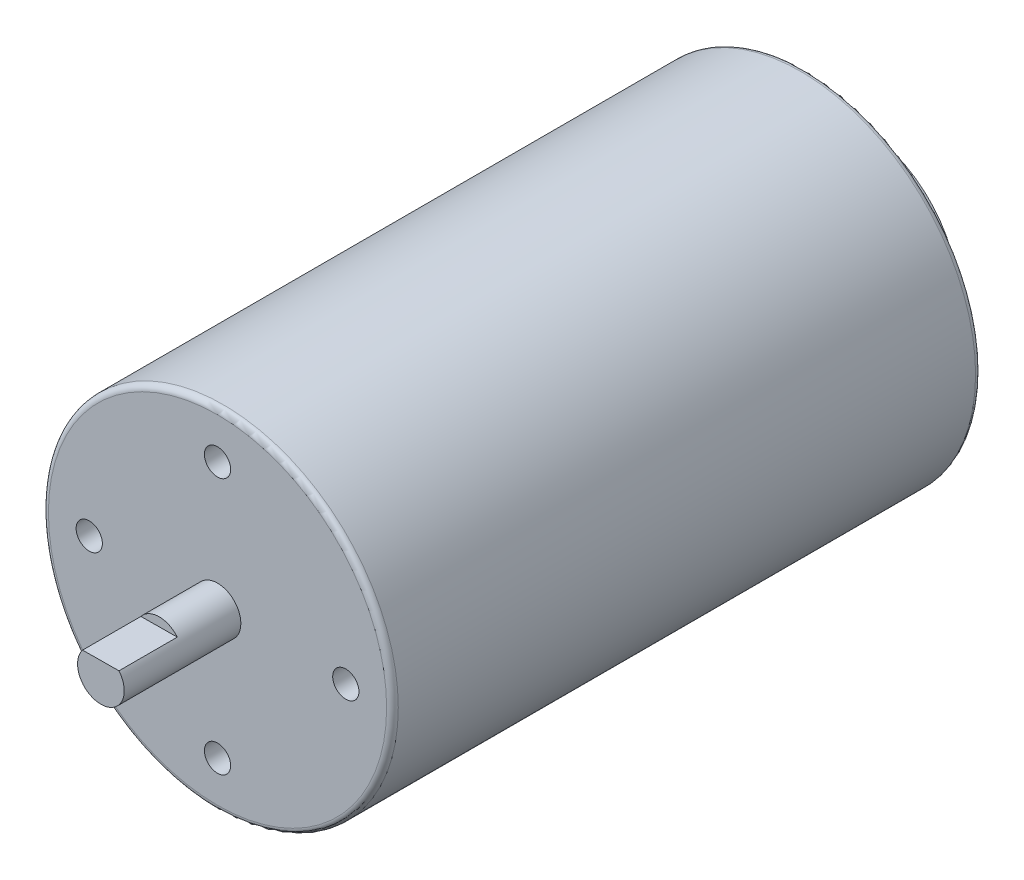
from build123d import *

# Parameters (mm, degrees)
ESQUISSE1_R             = 30
BOSS_EXTRU_1_DEPTH      = 101
ESQUISSE2_R             = 4
BOSS_EXTRU_2_DEPTH      = 20
ENL_V_START             = -10
ENL_V_MAT_EXTRU_1_DEPTH = 10
CONG_1_R                = 1
ESQUISSE4_R             = 17
BOSS_EXTRU_3_DEPTH      = 9
ESQUISSE5_R             = 2.25
ENL_V_MAT_EXTRU_2_DEPTH = 9
ESQUISSE7_W             = 20
ESQUISSE7_H             = 79


with BuildPart() as part:
    # Esquisse1 → Boss.-Extru.1 (new body)
    with BuildSketch(Plane(origin=(0, 0, 0), x_dir=(0, 1, 0), z_dir=(0, 0, 1))):
        with Locations(Location((0, 0, 0), (0, 0, 270))):
            Circle(ESQUISSE1_R)
    extrude(amount=BOSS_EXTRU_1_DEPTH)

    # Esquisse2 → Boss.-Extru.2 (add)
    with BuildSketch(Plane.XY.offset(101)):
        Circle(ESQUISSE2_R)
    extrude(amount=BOSS_EXTRU_2_DEPTH)

    # Esquisse3 → Enlèv. mat.-Extru.1 (cut)
    with BuildSketch(Plane.XY.offset(121).offset(ENL_V_START)):
        with BuildLine():
            Line((-3.142677151, 2.4745869), (3.101981411, 2.5254131))
            ThreePointArc((3.101981411, 2.5254131), (-0.032555514, 3.999867515), (-3.142677151, 2.4745869))
        make_face()
    extrude(amount=ENL_V_MAT_EXTRU_1_DEPTH, mode=Mode.SUBTRACT)

    # Congé1
    cong_1_edges = [part.edges().sort_by_distance(p)[0] for p in [
        (-30, 0, 0),
        (-30, 0, 101),
    ]]
    fillet(cong_1_edges, radius=CONG_1_R)

    # Esquisse4 → Boss.-Extru.3 (add)
    with BuildSketch(Plane(origin=(0, 0, 0), x_dir=(1, 0, 0), z_dir=(0, 0, -1))):
        Circle(ESQUISSE4_R)
    extrude(amount=BOSS_EXTRU_3_DEPTH)

    # Esquisse5 → Enlèv. mat.-Extru.2 (cut)
    with BuildSketch(Plane.XY.offset(101)):
        with Locations((0, 22)):
            Circle(ESQUISSE5_R)
        with Locations((22, 0)):
            Circle(ESQUISSE5_R)
        with Locations((0, -22)):
            Circle(ESQUISSE5_R)
        with Locations((-22, 0)):
            Circle(ESQUISSE5_R)
    extrude(amount=-ENL_V_MAT_EXTRU_2_DEPTH, mode=Mode.SUBTRACT)

    # Esquisse7 → Enlèvement de matière-Révolution1 (revolve, cut)
    with BuildSketch(Plane.YZ, mode=Mode.PRIVATE) as enl_vement_de_mati_re_r_volution1_sk:
        with Locations((-10, 50.5)):
            Rectangle(ESQUISSE7_W, ESQUISSE7_H)
    revolve(enl_vement_de_mati_re_r_volution1_sk.sketch.rotate(Axis((0, 0, 90), (0, 0, -1)), 128.217378369), axis=Axis((0, 0, 90), (0, 0, -1)), mode=Mode.SUBTRACT)


solid = part.part
